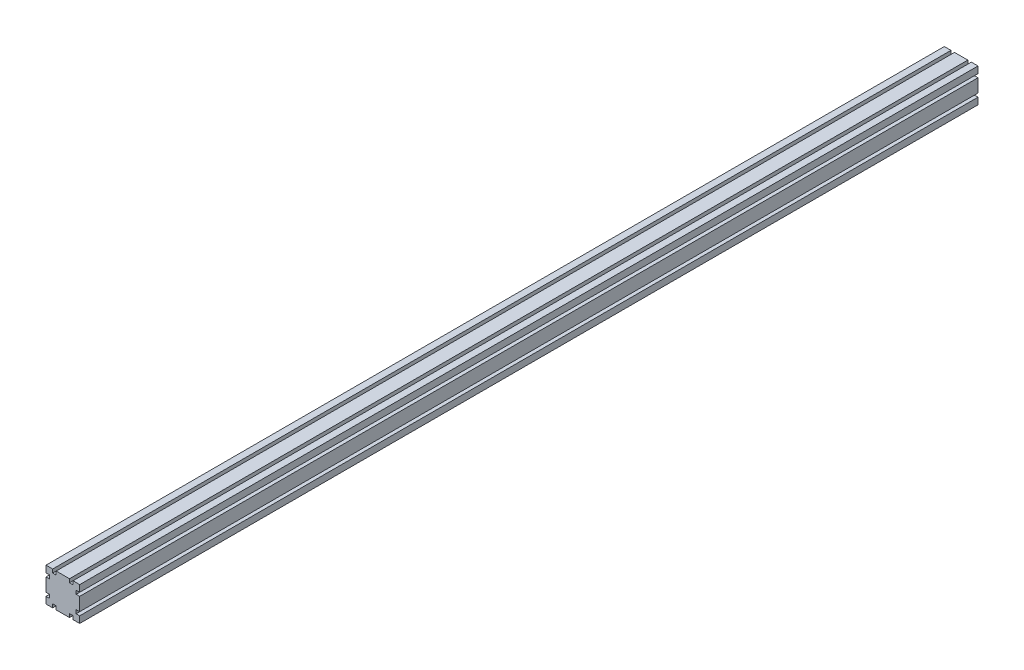
from build123d import *

# Parameters (mm, degrees)
PROFILE_DEPTH = 2032


with BuildPart() as part:
    # Sketch1 → Profile (new body)
    with BuildSketch(Plane.XY):
        Polygon((-38.1, -38.1), (-23.05, -38.1), (-23.05, -30.1), (-15.05, -30.1), (-15.05, -38.1), (15.05, -38.1), (15.05, -30.1), (23.05, -30.1), (23.05, -38.1), (38.1, -38.1), (38.1, -23.05), (30.1, -23.05), (30.1, -15.05), (38.1, -15.05), (38.1, 15.05), (30.1, 15.05), (30.1, 23.05), (38.1, 23.05), (38.1, 38.1), (23.05, 38.1), (23.05, 30.1), (15.05, 30.1), (15.05, 38.1), (-15.05, 38.1), (-15.05, 30.1), (-23.05, 30.1), (-23.05, 38.1), (-38.1, 38.1), (-38.1, 23.05), (-30.1, 23.05), (-30.1, 15.05), (-38.1, 15.05), (-38.1, -15.05), (-30.1, -15.05), (-30.1, -23.05), (-38.1, -23.05), align=None)
    extrude(amount=PROFILE_DEPTH)


solid = part.part
